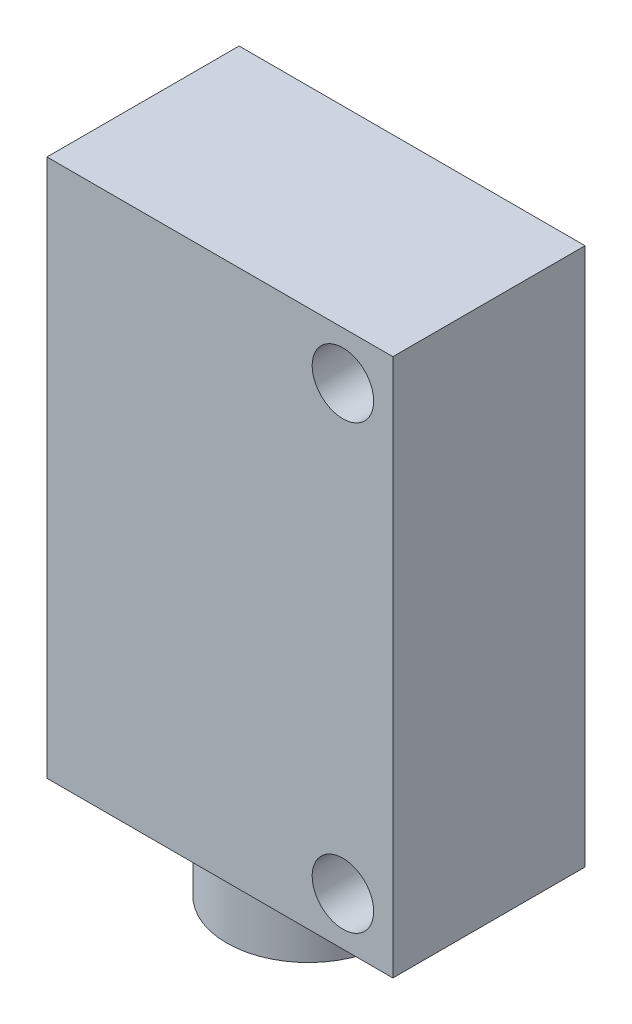
from build123d import *

# Parameters (mm, degrees)
ESQUISSE1_W             = 18
ESQUISSE1_H             = 28
BOSS_EXTRU_1_DEPTH      = 10
ESQUISSE3_R             = 4.25
BOSS_EXTRU_2_DEPTH      = 3.5
ESQUISSE4_R             = 1.6
ENL_V_MAT_EXTRU_1_DEPTH = 10.2
ESQUISSE5_R             = 1.6
ENL_V_MAT_EXTRU_2_DEPTH = 10.2
ESQUISSE6_W             = 6.88236931
ESQUISSE6_H             = 23.48997152
BOSS_EXTRU_3_DEPTH      = 1


with BuildPart() as part:
    # Esquisse1 → Boss.-Extru.1 (new body)
    with BuildSketch(Plane.XY):
        with Locations((9, 14)):
            Rectangle(ESQUISSE1_W, ESQUISSE1_H)
    extrude(amount=BOSS_EXTRU_1_DEPTH)

    # Esquisse3 → Boss.-Extru.2 (add)
    with BuildSketch(Plane.XZ):
        with Locations(Location((8.6, 5, 0), (0, 0, 90))):
            Circle(ESQUISSE3_R)
    extrude(amount=BOSS_EXTRU_2_DEPTH)

    # Esquisse4 → Enlèv. mat.-Extru.1 (cut)
    with BuildSketch(Plane(origin=(0, 0, 0), x_dir=(-1, 0, 0), z_dir=(0, 0, -1))):
        with Locations((-15.4, 25.5)):
            Circle(ESQUISSE4_R)
    extrude(amount=-ENL_V_MAT_EXTRU_1_DEPTH, mode=Mode.SUBTRACT)

    # Esquisse5 → Enlèv. mat.-Extru.2 (cut)
    with BuildSketch(Plane(origin=(0, 0, 0), x_dir=(-1, 0, 0), z_dir=(0, 0, -1))):
        with Locations((-15.4, 2.5)):
            Circle(ESQUISSE5_R)
    extrude(amount=-ENL_V_MAT_EXTRU_2_DEPTH, mode=Mode.SUBTRACT)

    # Esquisse6 → Boss.-Extru.3 (add)
    with BuildSketch(Plane.ZY):
        with Locations((5.178101781, 13.870853196)):
            Rectangle(ESQUISSE6_W, ESQUISSE6_H)
    extrude(amount=BOSS_EXTRU_3_DEPTH)


solid = part.part
